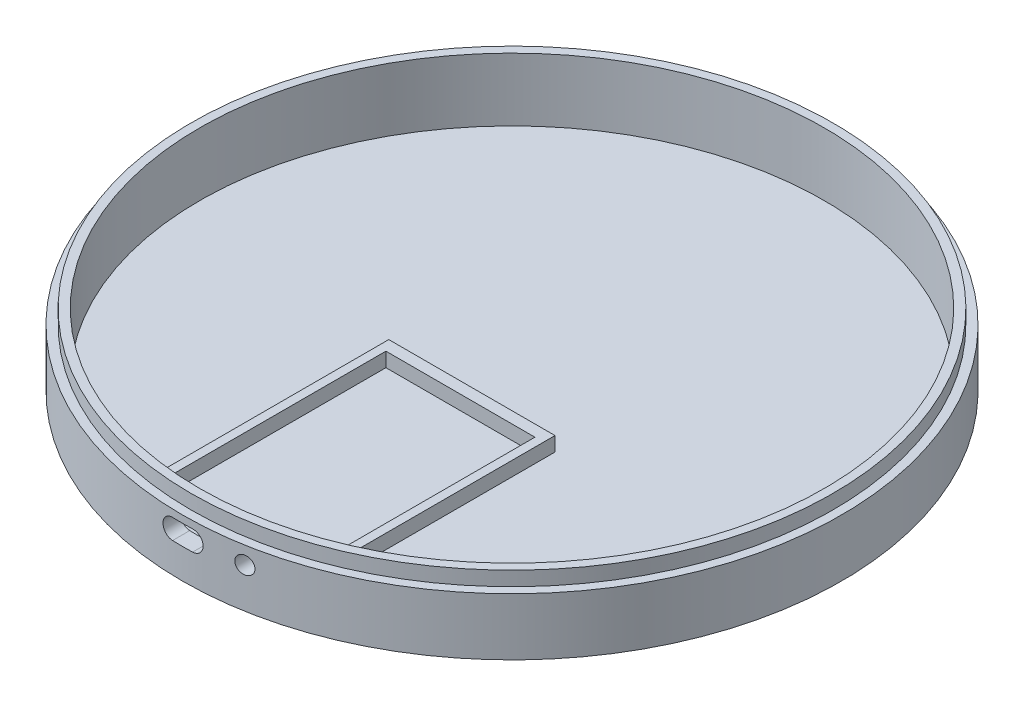
from build123d import *

# Parameters (mm, degrees)
SKETCH2_R           = 115
BOSS_EXTRUDE1_DEPTH = 20
SKETCH3_R           = 112
BOSS_EXTRUDE5_DEPTH = 5
SKETCH6_R           = 109
CUT_EXTRUDE2_DEPTH  = 22
SKETCH9_W           = 58
SKETCH9_H           = 90
BOSS_EXTRUDE9_DEPTH = 5
SKETCH10_W          = 52
SKETCH10_H          = 86
CUT_EXTRUDE3_DEPTH  = 5
CUT_EXTRUDE4_DEPTH  = 165.544826719
SKETCH13_R          = 3
CUT_EXTRUDE5_DEPTH  = 165.544826874


with BuildPart() as part:
    # Sketch2 → Boss-Extrude1 (new body)
    with BuildSketch(Plane(origin=(0, 0, 0), x_dir=(1, 0, 0), z_dir=(0, 1, 0))):
        with Locations(Location((0, 0, 0), (0, 0, 270))):
            Circle(SKETCH2_R)
    extrude(amount=BOSS_EXTRUDE1_DEPTH)

    # Sketch3 → Boss-Extrude5 (add)
    with BuildSketch(Plane(origin=(0, 20, 0), x_dir=(1, 0, 0), z_dir=(0, 1, 0))):
        with Locations(Location((0, 0, 0), (0, 0, 270))):
            Circle(SKETCH3_R)
    extrude(amount=BOSS_EXTRUDE5_DEPTH)

    # Sketch6 → Cut-Extrude2 (cut)
    with BuildSketch(Plane(origin=(0, 25, 0), x_dir=(1, 0, 0), z_dir=(0, 1, 0))):
        with Locations(Location((0, 0, 0), (0, 0, 270))):
            Circle(SKETCH6_R)
    extrude(amount=-CUT_EXTRUDE2_DEPTH, mode=Mode.SUBTRACT)

    # Sketch9 → Boss-Extrude9 (add)
    with BuildSketch(Plane(origin=(0, 3, 0), x_dir=(1, 0, 0), z_dir=(0, 1, 0))):
        with Locations((0, -59)):
            Rectangle(SKETCH9_W, SKETCH9_H)
    extrude(amount=BOSS_EXTRUDE9_DEPTH)

    # Sketch10 → Cut-Extrude3 (cut)
    with BuildSketch(Plane(origin=(0, 8, 0), x_dir=(1, 0, 0), z_dir=(0, 1, 0))):
        with Locations((0, -61)):
            Rectangle(SKETCH10_W, SKETCH10_H)
    extrude(amount=-CUT_EXTRUDE3_DEPTH, mode=Mode.SUBTRACT)

    # Sketch12 → Cut-Extrude4 (cut, through all)
    with BuildSketch(Plane.XY):
        with BuildLine():
            Line((-3.5, 17.5), (3.5, 17.5))
            ThreePointArc((3.5, 17.5), (7, 14), (3.5, 10.5))
            Line((3.5, 10.5), (-3.5, 10.5))
            ThreePointArc((-3.5, 10.5), (-7, 14), (-3.5, 17.5))
        make_face()
    extrude(amount=CUT_EXTRUDE4_DEPTH, mode=Mode.SUBTRACT)

    # Sketch13 → Cut-Extrude5 (cut, through all)
    with BuildSketch(Plane.XY):
        with Locations(Location((20, 14, 0), (0, 0, 180))):
            Circle(SKETCH13_R)
    extrude(amount=CUT_EXTRUDE5_DEPTH, mode=Mode.SUBTRACT)


solid = part.part
